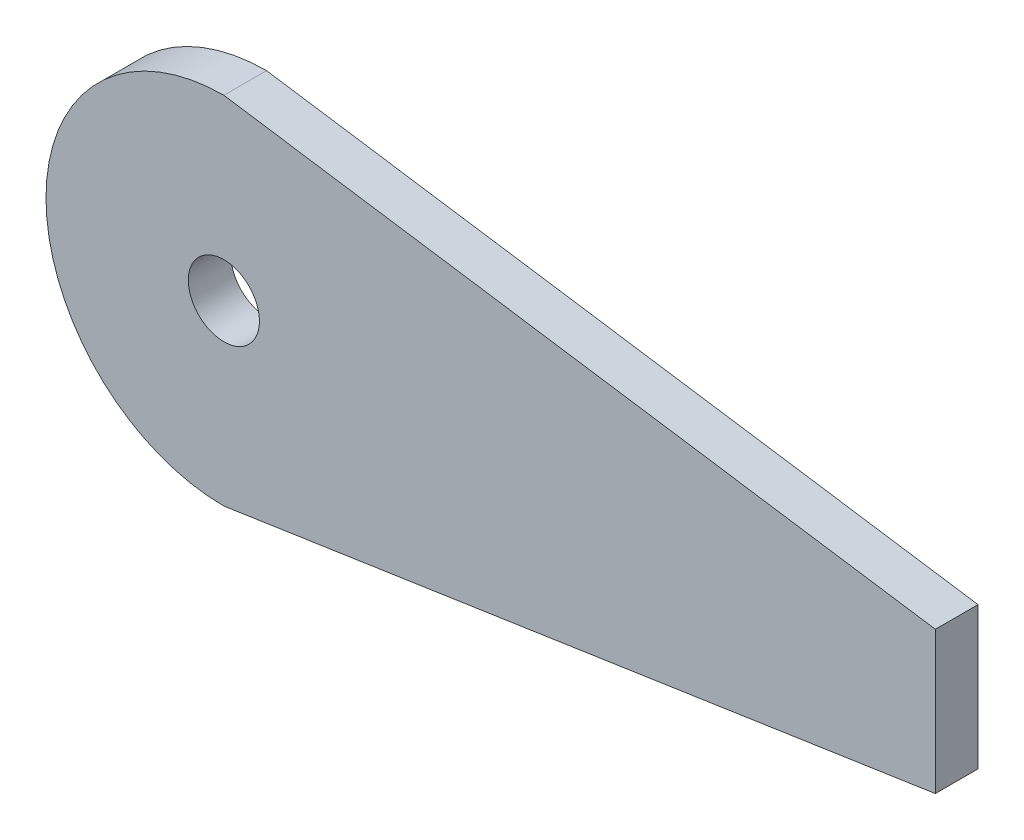
from build123d import *

# Parameters (mm, degrees)
SKETCH1_R           = 2.5
BOSS_EXTRUDE1_DEPTH = 3


with BuildPart() as part:
    # Sketch1 → Boss-Extrude1 (new body)
    with BuildSketch(Plane.XY):
        with BuildLine():
            Line((0, 12.5), (50, 5))
            Line((50, 5), (50, -5))
            Line((50, -5), (0, -12.5))
            ThreePointArc((0, -12.5), (-12.5, 0), (0, 12.5))
        make_face()
        Circle(SKETCH1_R, mode=Mode.SUBTRACT)
    extrude(amount=BOSS_EXTRUDE1_DEPTH)


solid = part.part
